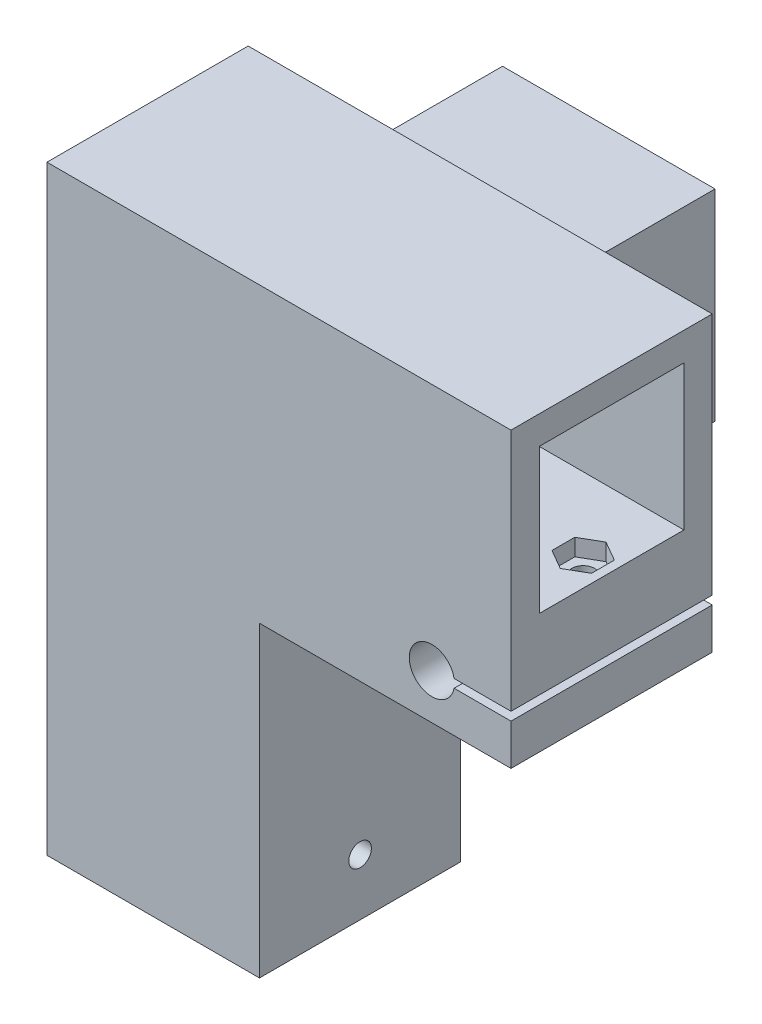
from build123d import *

# Parameters (mm, degrees)
BOSS_EXTRUDE1_DEPTH = 35.6
SHELL1_T            = -5
SKETCH5_W           = 35.6
SKETCH5_H           = 35.6
CUT_EXTRUDE2_DEPTH  = 5
BOSS_EXTRUDE2_DEPTH = 85
BOSS_EXTRUDE3_DEPTH = 5
BOSS_EXTRUDE4_DEPTH = 49.4
BOSS_EXTRUDE5_DEPTH = 35.6
SKETCH10_W          = 35.6
SKETCH10_H          = 35.6
CUT_EXTRUDE3_DEPTH  = 2.9
SKETCH13_W          = 35.6
SKETCH13_H          = 35.6
SKETCH13_W_2        = 25.6
SKETCH13_H_2        = 25.6
CUT_EXTRUDE4_DEPTH  = 5
SKETCH14_W          = 35.6
SKETCH14_H          = 35.6
CUT_EXTRUDE5_DEPTH  = 5
SKETCH15_R          = 2
CUT_EXTRUDE7_DEPTH  = 3
SKETCH16_R          = 2
CUT_EXTRUDE8_DEPTH  = 10
CUT_EXTRUDE9_START  = -2
SKETCH16_3_R        = 2
CUT_EXTRUDE9_DEPTH  = 3
BOSS_EXTRUDE7_START = 2
SKETCH18_R          = 2
BOSS_EXTRUDE7_DEPTH = 2
SKETCH20_R          = 2
CUT_EXTRUDE10_DEPTH = 24


with BuildPart() as part:
    # Sketch1 → Boss-Extrude1 (new body)
    with BuildSketch(Plane(origin=(0, 0, 0), x_dir=(0, 0, -1), z_dir=(1, 0, 0))):
        Polygon((0, 0), (85.6, 0), (85.6, -35.6), (35.6, -35.6), (35.6, -85.6), (0, -85.6), align=None)
    extrude(amount=BOSS_EXTRUDE1_DEPTH)

    # Shell1
    shell1_openings = [part.faces().sort_by_distance(p)[0] for p in [
        (17.8, -85.6, -17.8),
        (17.8, -17.8, -85.6),
    ]]
    offset(amount=SHELL1_T, openings=shell1_openings, kind=Kind.INTERSECTION)

    # Sketch5 → Cut-Extrude2 (cut)
    with BuildSketch(Plane(origin=(0, 0, 0), x_dir=(1, 0, 0), z_dir=(0, 1, 0))):
        with Locations((17.8, 17.8)):
            Rectangle(SKETCH5_W, SKETCH5_H)
    extrude(amount=-CUT_EXTRUDE2_DEPTH, mode=Mode.SUBTRACT)

    # Sketch6 → Boss-Extrude2 (add)
    with BuildSketch(Plane.ZY):
        Polygon((-5, 0), (-5, 20.6), (-30.6, 20.6), (-30.6, 0), (-30.6, -5), (-35.6, -5), (-35.6, 25.6), (0, 25.6), (0, -5), (-5, -5), align=None)
    extrude(amount=-BOSS_EXTRUDE2_DEPTH)

    # Sketch6<2> → Boss-Extrude3 (add)
    with BuildSketch(Plane.ZY):
        Polygon((-5, -5), (-5, 0), (-5, 20.6), (-30.6, 20.6), (-30.6, 0), (-30.6, -5), align=None)
    extrude(amount=-BOSS_EXTRUDE3_DEPTH)

    # Sketch7 → Boss-Extrude4 (add)
    with BuildSketch(Plane(origin=(85, 0, 0), x_dir=(0, 0, -1), z_dir=(1, 0, 0))):
        Polygon((0, -5), (0, -10), (35.6, -10), (35.6, -5), (30.6, -5), (5, -5), align=None)
    extrude(amount=-BOSS_EXTRUDE4_DEPTH)

    # Sketch8 → Boss-Extrude5 (add)
    with BuildSketch(Plane.XY):
        with BuildLine():
            ThreePointArc((72.029058411, -18.991), (64.1, -18.241), (72.029058411, -17.491))
            Line((72.029058411, -17.491), (82.1, -17.491))
            Line((82.1, -17.491), (82.1, -10))
            Line((82.1, -10), (35.6, -10))
            Line((35.6, -10), (35.6, -26.241))
            Line((35.6, -26.241), (68.1, -26.241))
            Line((68.1, -26.241), (82.1, -26.241))
            Line((82.1, -26.241), (82.1, -18.991))
            Line((82.1, -18.991), (72.029058411, -18.991))
        make_face()
    extrude(amount=-BOSS_EXTRUDE5_DEPTH)

    # Sketch10 → Cut-Extrude3 (cut)
    with BuildSketch(Plane(origin=(85, 0, 0), x_dir=(0, 0, -1), z_dir=(1, 0, 0))):
        with Locations((17.8, 7.8)):
            Rectangle(SKETCH10_W, SKETCH10_H)
    extrude(amount=-CUT_EXTRUDE3_DEPTH, mode=Mode.SUBTRACT)

    # Sketch13 → Cut-Extrude4 (cut)
    # profile 1 of 2: a face of its own
    with BuildSketch(Plane.XZ.offset(85.6)):
        with Locations((17.8, -17.8)):
            Rectangle(SKETCH13_W, SKETCH13_H)
        with Locations((17.8, -17.8)):
            Rectangle(SKETCH13_W_2, SKETCH13_H_2, mode=Mode.SUBTRACT)
    # profile 2 of 2: a face of its own
    with BuildSketch(Plane.XZ.offset(85.6)):
        with Locations((17.8, -17.8)):
            Rectangle(SKETCH13_W_2, SKETCH13_H_2)
    extrude(amount=-CUT_EXTRUDE4_DEPTH, mode=Mode.SUBTRACT)

    # Sketch14 → Cut-Extrude5 (cut)
    with BuildSketch(Plane(origin=(0, 0, -85.6), x_dir=(-1, 0, 0), z_dir=(0, 0, -1))):
        with Locations((-17.8, -17.8)):
            Rectangle(SKETCH14_W, SKETCH14_H)
    extrude(amount=-CUT_EXTRUDE5_DEPTH, mode=Mode.SUBTRACT)

    # Sketch15 → Cut-Extrude7 (cut)
    # profile 1 of 3: a face of its own
    with BuildSketch(Plane(origin=(0, -5, 0), x_dir=(1, 0, 0), z_dir=(0, 1, 0))):
        with BuildLine():
            Line((79.064529206, 17.8), (80.564529206, 17.8))
            Line((80.564529206, 17.8), (80.564529206, 19.820725942))
            Line((80.564529206, 19.820725942), (77.064529206, 21.841451884))
            Line((77.064529206, 21.841451884), (73.564529206, 19.820725942))
            Line((73.564529206, 19.820725942), (73.564529206, 17.8))
            Line((73.564529206, 17.8), (75.064529206, 17.8))
            ThreePointArc((75.064529206, 17.8), (77.064529206, 19.8), (79.064529206, 17.8))
        make_face()
    # profile 2 of 3: a face of its own
    with BuildSketch(Plane(origin=(0, -5, 0), x_dir=(1, 0, 0), z_dir=(0, 1, 0))):
        with BuildLine():
            Line((80.564529206, 15.779274058), (80.564529206, 17.8))
            Line((80.564529206, 17.8), (79.064529206, 17.8))
            ThreePointArc((79.064529206, 17.8), (77.064529206, 15.8), (75.064529206, 17.8))
            Line((75.064529206, 17.8), (73.564529206, 17.8))
            Line((73.564529206, 17.8), (73.564529206, 15.779274058))
            Line((73.564529206, 15.779274058), (77.064529206, 13.758548116))
            Line((77.064529206, 13.758548116), (80.564529206, 15.779274058))
        make_face()
    # profile 3 of 3: a face of its own
    with BuildSketch(Plane(origin=(0, -5, 0), x_dir=(1, 0, 0), z_dir=(0, 1, 0))):
        Polygon((44.1, 19.820725942), (44.1, 15.779274058), (47.6, 13.758548116), (51.1, 15.779274058), (51.1, 19.820725942), (47.6, 21.841451884), align=None)
        with Locations(Location((47.6, 17.8, 0), (0, 0, 270))):
            Circle(SKETCH15_R, mode=Mode.SUBTRACT)
    extrude(amount=-CUT_EXTRUDE7_DEPTH, mode=Mode.SUBTRACT)

    # Sketch16 → Cut-Extrude8 (cut)
    with BuildSketch(Plane(origin=(35.6, 0, 0), x_dir=(0, 0, -1), z_dir=(1, 0, 0))):
        with Locations((45.6, -17.8)):
            Circle(SKETCH16_R)
        with Locations((17.8, -36.241)):
            Circle(SKETCH16_R)
        with Locations((70.6, -17.8)):
            Circle(SKETCH16_R)
        with Locations((17.8, -70.6)):
            Circle(SKETCH16_R)
    extrude(amount=-CUT_EXTRUDE8_DEPTH, mode=Mode.SUBTRACT)

    # Sketch16<3> → Cut-Extrude9 (cut)
    # profile 1 of 4: a face of its own
    with BuildSketch(Plane(origin=(35.6, 0, 0), x_dir=(0, 0, -1), z_dir=(1, 0, 0)).offset(CUT_EXTRUDE9_START)):
        Polygon((15.779274058, -39.741), (19.820725942, -39.741), (21.841451884, -36.241), (19.820725942, -32.741), (15.779274058, -32.741), (13.758548116, -36.241), align=None)
        with Locations((17.8, -36.241)):
            Circle(SKETCH16_3_R, mode=Mode.SUBTRACT)
    # profile 2 of 4: a face of its own
    with BuildSketch(Plane(origin=(35.6, 0, 0), x_dir=(0, 0, -1), z_dir=(1, 0, 0)).offset(CUT_EXTRUDE9_START)):
        Polygon((42.096530621, -15.785295147), (42.103479727, -19.826741057), (45.606949106, -21.84144591), (49.103469379, -19.814704853), (49.096520273, -15.773258943), (45.593050894, -13.75855409), align=None)
        with Locations((45.6, -17.8)):
            Circle(SKETCH16_3_R, mode=Mode.SUBTRACT)
    # profile 3 of 4: a face of its own
    with BuildSketch(Plane(origin=(35.6, 0, 0), x_dir=(0, 0, -1), z_dir=(1, 0, 0)).offset(CUT_EXTRUDE9_START)):
        Polygon((67.166795923, -15.667761012), (67.036824831, -19.707122453), (70.470028908, -21.839361441), (74.033204077, -19.932238988), (74.163175169, -15.892877547), (70.729971092, -13.760638559), align=None)
        with Locations((70.6, -17.8)):
            Circle(SKETCH16_3_R, mode=Mode.SUBTRACT)
    # profile 4 of 4: a face of its own
    with BuildSketch(Plane(origin=(35.6, 0, 0), x_dir=(0, 0, -1), z_dir=(1, 0, 0)).offset(CUT_EXTRUDE9_START)):
        Polygon((21.841432858, -70.58759896), (19.809976813, -67.093815957), (15.768543955, -67.106216997), (13.758567142, -70.61240104), (15.790023187, -74.106184043), (19.831456045, -74.093783003), align=None)
    extrude(amount=-CUT_EXTRUDE9_DEPTH, mode=Mode.SUBTRACT)

    # Sketch18 → Boss-Extrude7 (add)
    with BuildSketch(Plane(origin=(35.6, 0, 0), x_dir=(0, 0, -1), z_dir=(1, 0, 0)).offset(BOSS_EXTRUDE7_START)):
        Polygon((35.6, -35.6), (80.6, -35.6), (80.6, 0), (35.6, 0), (35.6, -26.241), (0, -26.241), (0, -80.6), (35.6, -80.6), align=None)
        with Locations((70.6, -17.8)):
            Circle(SKETCH18_R, mode=Mode.SUBTRACT)
        with Locations((45.6, -17.8)):
            Circle(SKETCH18_R, mode=Mode.SUBTRACT)
        with Locations((17.8, -36.241)):
            Circle(SKETCH18_R, mode=Mode.SUBTRACT)
        with Locations((17.8, -70.6)):
            Circle(SKETCH18_R, mode=Mode.SUBTRACT)
    extrude(amount=-BOSS_EXTRUDE7_DEPTH)

    # Sketch20 → Cut-Extrude10 (cut)
    with BuildSketch(Plane(origin=(0, -5, 0), x_dir=(1, 0, 0), z_dir=(0, 1, 0))):
        with Locations(Location((77.064529206, 17.8, 0), (0, 0, 270))):
            Circle(SKETCH20_R)
        with Locations(Location((47.6, 17.8, 0), (0, 0, 270))):
            Circle(SKETCH20_R)
    extrude(amount=-CUT_EXTRUDE10_DEPTH, mode=Mode.SUBTRACT)


solid = part.part
